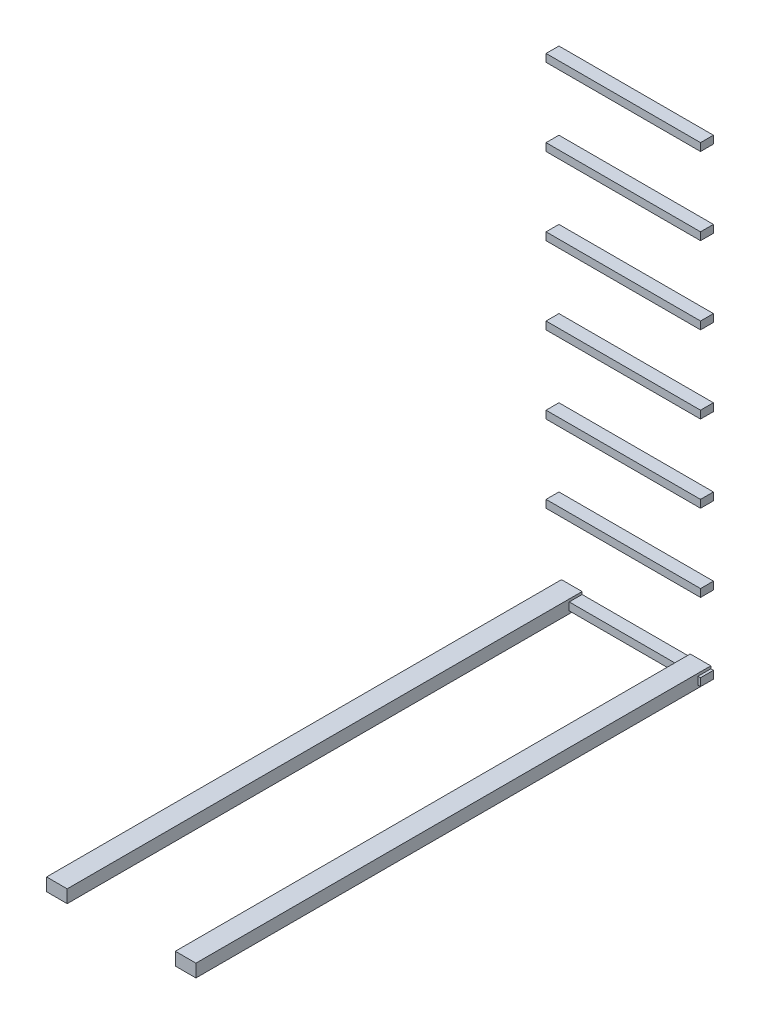
from build123d import *

# Parameters (mm, degrees)
SKETCH_1_W      = 80
SKETCH_1_H      = 50
EXTRUDE_1_DEPTH = 2000
SKETCH_2_W      = 80
SKETCH_2_H      = 50
EXTRUDE_2_DEPTH = 2000
SKETCH_3_W      = 600
SKETCH_3_H      = 30
EXTRUDE_3_DEPTH = 50
SKETCH_4_W      = 600
SKETCH_4_H      = 30
EXTRUDE_4_DEPTH = 50
SKETCH_5_W      = 600
SKETCH_5_H      = 30
EXTRUDE_5_DEPTH = 50
SKETCH_6_W      = 600
SKETCH_6_H      = 30
EXTRUDE_6_DEPTH = 50
SKETCH_7_W      = 600
SKETCH_7_H      = 30
EXTRUDE_7_DEPTH = 50
SKETCH_8_W      = 600
SKETCH_8_H      = 30
EXTRUDE_8_DEPTH = 50
SKETCH_9_W      = 600
SKETCH_9_H      = 30
EXTRUDE_9_DEPTH = 50


with BuildPart() as part:
    # 草图1 → 凸台-拉伸1 (new body)
    with BuildSketch(Plane.XY):
        with Locations((-250, 0)):
            Rectangle(SKETCH_1_W, SKETCH_1_H)
    extrude(amount=EXTRUDE_1_DEPTH)



with BuildPart() as body_2:
    # 草图2 → 凸台-拉伸2 (new body)
    with BuildSketch(Plane.XY):
        with Locations((250, 0)):
            Rectangle(SKETCH_2_W, SKETCH_2_H)
    extrude(amount=EXTRUDE_2_DEPTH)


with BuildPart() as part_1:
    add(part.part)

    add(body_2.part)  # 凸台-拉伸3 merges body 2
    # 草图3 → 凸台-拉伸3 (add)
    with BuildSketch(Plane.XY):
        Rectangle(SKETCH_3_W, SKETCH_3_H)
    extrude(amount=EXTRUDE_3_DEPTH)


with BuildPart() as body_2_2:
    # 草图4 → 凸台-拉伸4 (new body)
    with BuildSketch(Plane.XY):
        with Locations((0, 300)):
            Rectangle(SKETCH_4_W, SKETCH_4_H)
    extrude(amount=EXTRUDE_4_DEPTH)


with BuildPart() as body_3:
    # 草图5 → 凸台-拉伸5 (new body)
    with BuildSketch(Plane.XY):
        with Locations((0, 600)):
            Rectangle(SKETCH_5_W, SKETCH_5_H)
    extrude(amount=EXTRUDE_5_DEPTH)


with BuildPart() as body_4:
    # 草图6 → 凸台-拉伸6 (new body)
    with BuildSketch(Plane.XY):
        with Locations((0, 900)):
            Rectangle(SKETCH_6_W, SKETCH_6_H)
    extrude(amount=EXTRUDE_6_DEPTH)


with BuildPart() as body_5:
    # 草图7 → 凸台-拉伸7 (new body)
    with BuildSketch(Plane.XY):
        with Locations((0, 1200)):
            Rectangle(SKETCH_7_W, SKETCH_7_H)
    extrude(amount=EXTRUDE_7_DEPTH)


with BuildPart() as body_6:
    # 草图8 → 凸台-拉伸8 (new body)
    with BuildSketch(Plane.XY):
        with Locations((0, 1500)):
            Rectangle(SKETCH_8_W, SKETCH_8_H)
    extrude(amount=EXTRUDE_8_DEPTH)


with BuildPart() as body_7:
    # 草图9 → 凸台-拉伸9 (new body)
    with BuildSketch(Plane.XY):
        with Locations((0, 1800)):
            Rectangle(SKETCH_9_W, SKETCH_9_H)
    extrude(amount=EXTRUDE_9_DEPTH)


solid = Compound([part_1.part, body_2_2.part, body_3.part, body_4.part, body_5.part, body_6.part, body_7.part])
